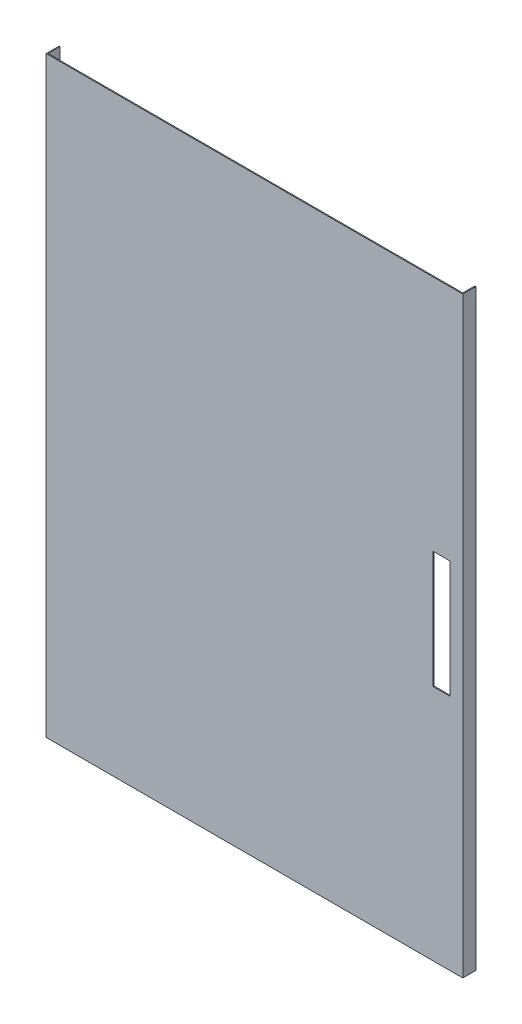
from build123d import *

# Parameters (mm, degrees)
PACK_SARJOR_KAPISI_KAPAK_1_START = 1040
PACK_SARJOR_KAPISI_KAPAK_1_DEPTH = 910
PACK_SARJOR_KAPISI_KAPAK_2_START = 27
SKETCH2_W                        = 26
SKETCH2_H                        = 180
PACK_SARJOR_KAPISI_KAPAK_2_DEPTH = 14


with BuildPart() as part:
    # Sketch1 → PACK_sarjor_kapisi_kapak_1 (new body)
    with BuildSketch(Plane(origin=(0, 0, 0), x_dir=(1, 0, 0), z_dir=(0, 1, 0)).offset(PACK_SARJOR_KAPISI_KAPAK_1_START)):
        Polygon((30, -40), (30, -20), (31.5, -20), (31.5, -38.5), (668.5, -38.5), (668.5, -20), (670, -20), (670, -40), align=None)
    extrude(amount=PACK_SARJOR_KAPISI_KAPAK_1_DEPTH)

    # Sketch2 → PACK_sarjor_kapisi_kapak_2 (cut)
    with BuildSketch(Plane.XY.offset(PACK_SARJOR_KAPISI_KAPAK_2_START)):
        with Locations((637, 1495)):
            Rectangle(SKETCH2_W, SKETCH2_H)
    extrude(amount=PACK_SARJOR_KAPISI_KAPAK_2_DEPTH, mode=Mode.SUBTRACT)


solid = part.part
